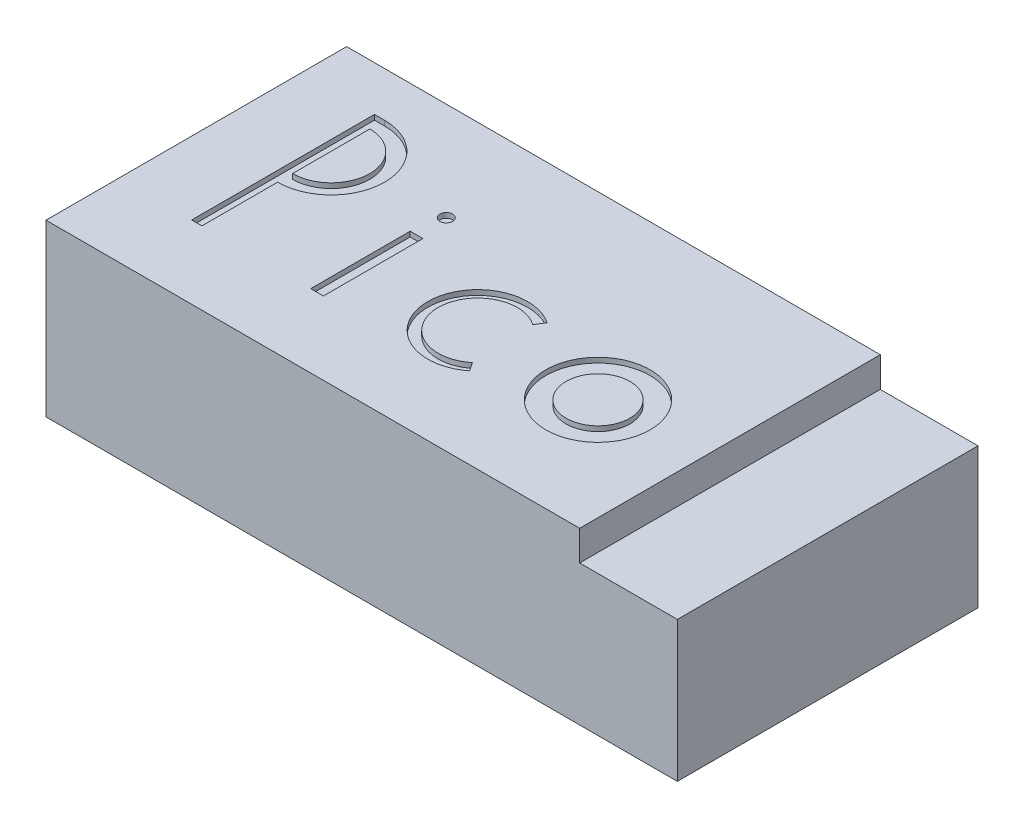
from build123d import *

# Parameters (mm, degrees)
SKETCH1_W           = 126
SKETCH1_H           = 60
BOSS_EXTRUDE1_DEPTH = 28
SKETCH2_W           = 106.5
SKETCH2_H           = 60
BOSS_EXTRUDE2_DEPTH = 6
SKETCH3_R           = 1.270837117
SKETCH3_R_2         = 10.401878768
SKETCH3_R_3         = 6.366682124
SKETCH3_W           = 2.541674233
SKETCH3_H           = 19.855616704
CUT_EXTRUDE1_DEPTH  = 1


with BuildPart() as part:
    # Sketch1 → Boss-Extrude1 (new body)
    with BuildSketch(Plane(origin=(0, 0, 0), x_dir=(1, 0, 0), z_dir=(0, 1, 0))):
        with Locations((63, 30)):
            Rectangle(SKETCH1_W, SKETCH1_H)
    extrude(amount=BOSS_EXTRUDE1_DEPTH)

    # Sketch2 → Boss-Extrude2 (add)
    with BuildSketch(Plane(origin=(0, 28, 0), x_dir=(1, 0, 0), z_dir=(0, 1, 0))):
        with Locations((53.25, 30)):
            Rectangle(SKETCH2_W, SKETCH2_H)
    extrude(amount=BOSS_EXTRUDE2_DEPTH)

    # Sketch3 → Cut-Extrude1 (cut)
    # profile 1 of 5: a face of its own
    with BuildSketch(Plane(origin=(0, 34, 0), x_dir=(1, 0, 0), z_dir=(0, 1, 0))):
        with Locations(Location((39.51710712, 40.365620358, 0), (0, 0, 270))):
            Circle(SKETCH3_R)
    # profile 2 of 5: a face of its own
    with BuildSketch(Plane(origin=(0, 34, 0), x_dir=(1, 0, 0), z_dir=(0, 1, 0))):
        with Locations(Location((86.125525447, 24.033278021, 0), (0, 0, 270))):
            Circle(SKETCH3_R_2)
        with Locations(Location((86.125525447, 24.033278021, 0), (0, 0, 270))):
            Circle(SKETCH3_R_3, mode=Mode.SUBTRACT)
    # profile 3 of 5: a face of its own
    with BuildSketch(Plane(origin=(0, 34, 0), x_dir=(1, 0, 0), z_dir=(0, 1, 0))):
        with BuildLine():
            Line((14.499134375, 40.429605669), (14.499134375, 14.579540085))
            Line((14.499134375, 14.579540085), (16.546664322, 14.579540085))
            Line((16.546664322, 14.579540085), (16.546664322, 29.680073446))
            ThreePointArc((16.546664322, 29.680073446), (27.232211234, 40.365620358), (16.546664322, 51.05116727))
            Line((16.546664322, 51.05116727), (14.499134375, 51.05116727))
            Line((14.499134375, 51.05116727), (14.499134375, 40.429605669))
        make_face()
        with BuildLine():
            Line((16.546664322, 48.080160925), (16.546664322, 32.651079791))
            ThreePointArc((16.546664322, 32.651079791), (24.26120489, 40.365620358), (16.546664322, 48.080160925))
        make_face(mode=Mode.SUBTRACT)
    # profile 4 of 5: a face of its own
    with BuildSketch(Plane(origin=(0, 34, 0), x_dir=(1, 0, 0), z_dir=(0, 1, 0))):
        with Locations((39.517107119, 24.507348437)):
            Rectangle(SKETCH3_W, SKETCH3_H)
    # profile 5 of 5: a face of its own
    with BuildSketch(Plane(origin=(0, 34, 0), x_dir=(1, 0, 0), z_dir=(0, 1, 0))):
        with BuildLine():
            Line((67.74148212, 32.262991734), (66.622002756, 30.534452251))
            ThreePointArc((66.622002756, 30.534452251), (54.221440679, 23.691888532), (67.166075127, 17.944623349))
            Line((67.166075127, 17.944623349), (68.322309862, 16.231868944))
            ThreePointArc((68.322309862, 16.231868944), (52.161989467, 23.672443665), (67.74148212, 32.262991734))
        make_face()
    extrude(amount=-CUT_EXTRUDE1_DEPTH, mode=Mode.SUBTRACT)


solid = part.part
